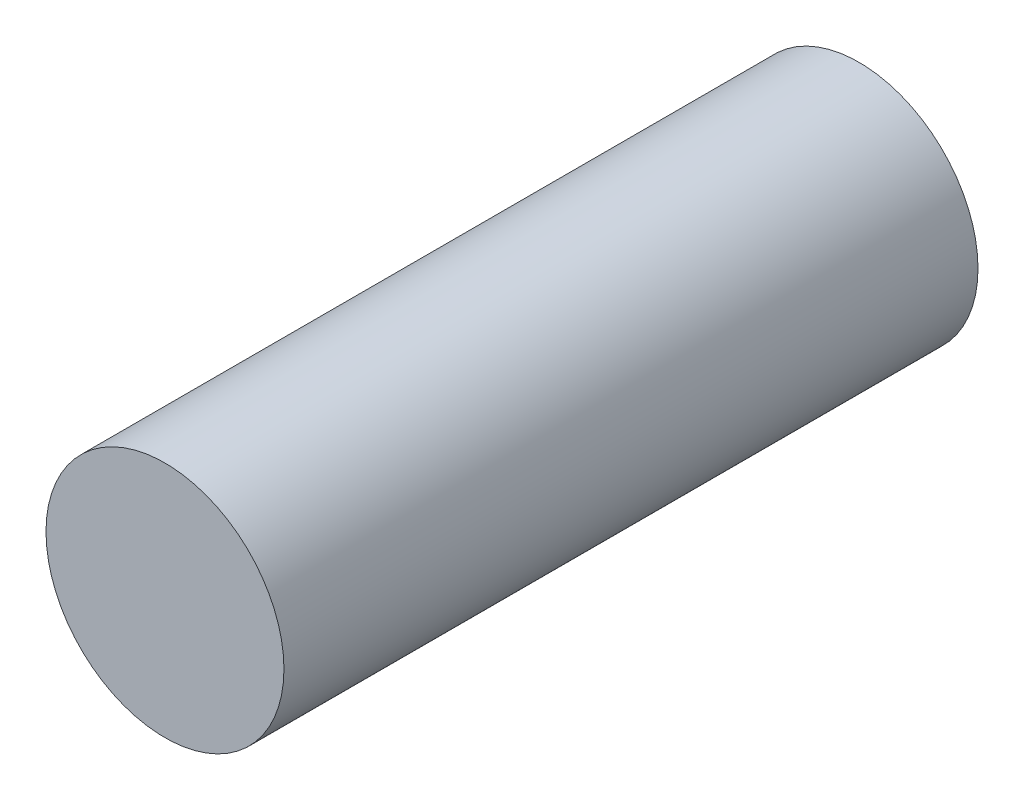
from build123d import *

# Parameters (mm, degrees)
SKETCH_1_R      = 30
EXTRUDE_1_DEPTH = 175


with BuildPart() as part:
    # 草图1 → 凸台-拉伸1 (new body)
    with BuildSketch(Plane.XY):
        Circle(SKETCH_1_R)
    extrude(amount=EXTRUDE_1_DEPTH)


solid = part.part
